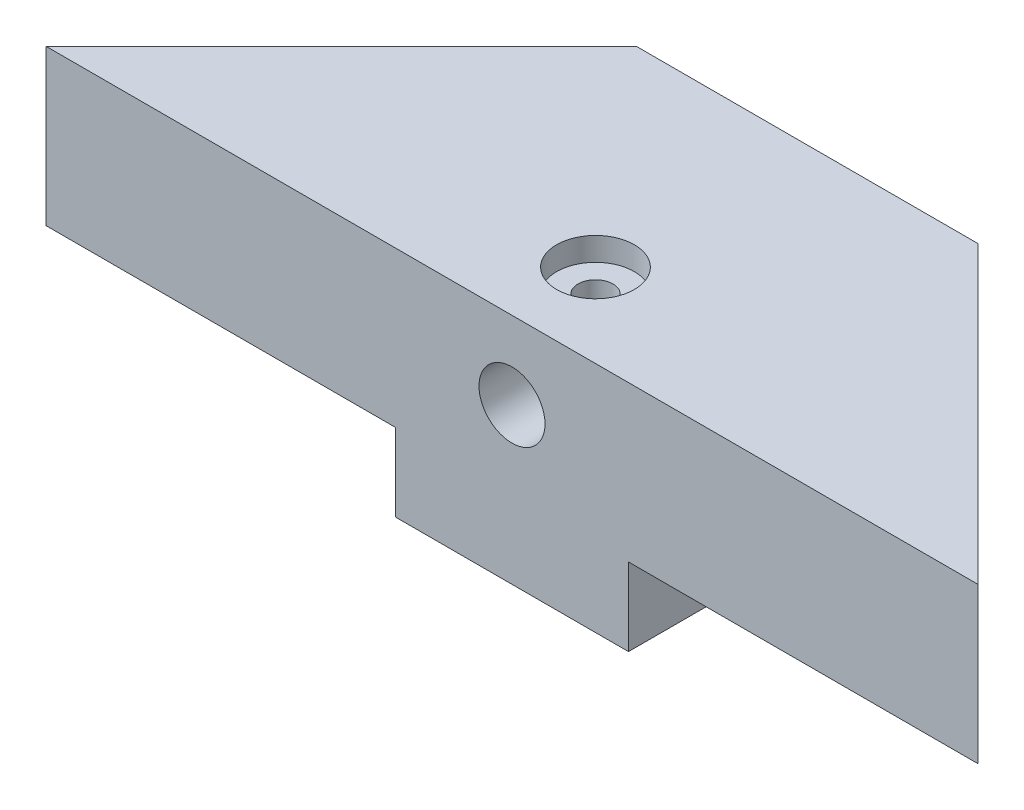
from build123d import *

# Parameters (mm, degrees)
BOSS_EXTRUDE1_DEPTH = 20
SKETCH2_R           = 5
CUT_EXTRUDE1_DEPTH  = 3
SKETCH3_R           = 2.25
CUT_EXTRUDE2_DEPTH  = 10
SKETCH4_R           = 4.25
CUT_EXTRUDE3_DEPTH  = 20
SKETCH5_W           = 30
SKETCH5_H           = 25
BOSS_EXTRUDE2_DEPTH = 10
SKETCH6_R           = 2.25
CUT_EXTRUDE7_DEPTH  = 10


with BuildPart() as part:
    # Sketch1 → Boss-Extrude1 (new body)
    with BuildSketch(Plane(origin=(0, 0, 0), x_dir=(1, 0, 0), z_dir=(0, 1, 0))):
        Polygon((0, 0), (60, 0), (22, 38), (0, 38), (-22, 38), (-60, 0), align=None)
    extrude(amount=BOSS_EXTRUDE1_DEPTH)

    # Sketch2 → Cut-Extrude1 (cut)
    with BuildSketch(Plane(origin=(0, 20, 0), x_dir=(1, 0, 0), z_dir=(0, 1, 0))):
        with Locations(Location((0, 10.75, 0), (0, 0, 270))):
            Circle(SKETCH2_R)
    extrude(amount=-CUT_EXTRUDE1_DEPTH, mode=Mode.SUBTRACT)

    # Sketch3 → Cut-Extrude2 (cut)
    with BuildSketch(Plane(origin=(0, 20, 0), x_dir=(1, 0, 0), z_dir=(0, 1, 0))):
        with Locations(Location((0, 10.75, 0), (0, 0, 270))):
            Circle(SKETCH3_R)
    extrude(amount=-CUT_EXTRUDE2_DEPTH, mode=Mode.SUBTRACT)

    # Sketch4 → Cut-Extrude3 (cut)
    with BuildSketch(Plane.XY):
        with Locations((0, 10)):
            Circle(SKETCH4_R)
    extrude(amount=-CUT_EXTRUDE3_DEPTH, mode=Mode.SUBTRACT)

    # Sketch5 → Boss-Extrude2 (add)
    with BuildSketch(Plane.XZ):
        with Locations((0, -12.5)):
            Rectangle(SKETCH5_W, SKETCH5_H)
    extrude(amount=BOSS_EXTRUDE2_DEPTH)

    # Sketch6 → Cut-Extrude7 (cut)
    with BuildSketch(Plane.XZ.offset(10)):
        with Locations(Location((-7.5, -12.5, 0), (0, 0, 270))):
            Circle(SKETCH6_R)
        with Locations(Location((7.5, -12.5, 0), (0, 0, 270))):
            Circle(SKETCH6_R)
    extrude(amount=-CUT_EXTRUDE7_DEPTH, mode=Mode.SUBTRACT)


solid = part.part
